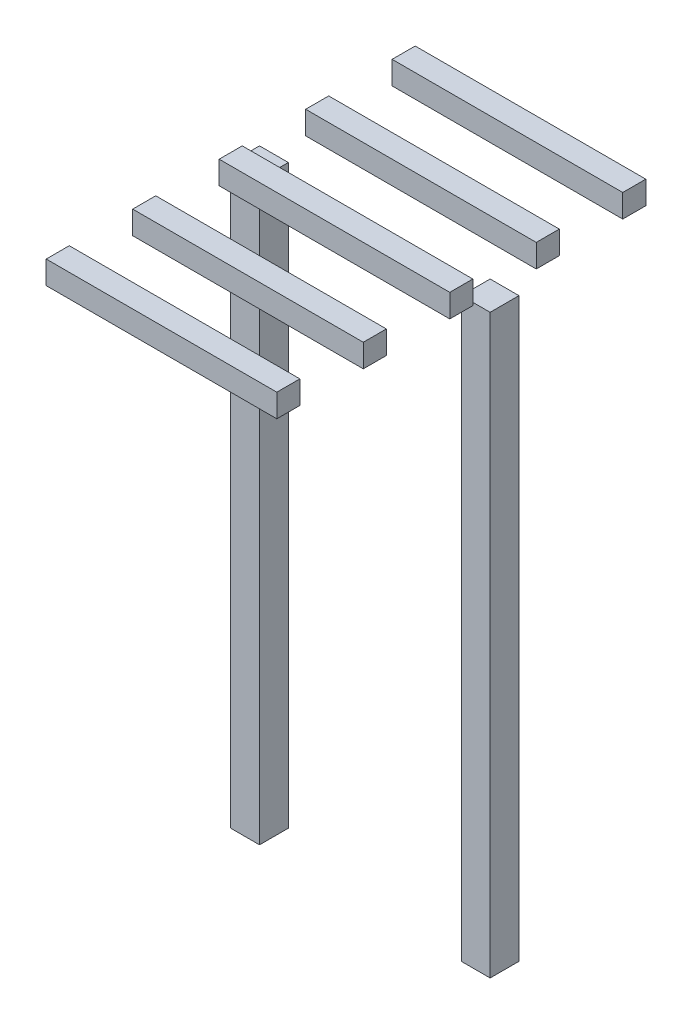
from build123d import *

# Parameters (mm, degrees)
SKETCH_1_W      = 100
SKETCH_1_H      = 100
EXTRUDE_1_DEPTH = 2000
SKETCH_2_W      = 100
SKETCH_2_H      = 100
EXTRUDE_2_DEPTH = 2000
SKETCH_3_W      = 800
SKETCH_3_H      = 80
EXTRUDE_3_DEPTH = 80
SKETCH_4_W      = 800
SKETCH_4_H      = 80
EXTRUDE_4_DEPTH = 80
SKETCH_5_W      = 800
SKETCH_5_H      = 80
EXTRUDE_5_DEPTH = 80
SKETCH_6_W      = 800
SKETCH_6_H      = 80
EXTRUDE_6_DEPTH = 80
SKETCH_7_W      = 800
SKETCH_7_H      = 80
EXTRUDE_7_DEPTH = 80


with BuildPart() as part:
    # 草图1 → 凸台-拉伸1 (new body)
    with BuildSketch(Plane(origin=(0, 0, 0), x_dir=(1, 0, 0), z_dir=(0, 1, 0))):
        with Locations((-400, 1000)):
            Rectangle(SKETCH_1_W, SKETCH_1_H)
    extrude(amount=EXTRUDE_1_DEPTH)


with BuildPart() as body_2:
    # 草图2 → 凸台-拉伸2 (new body)
    with BuildSketch(Plane(origin=(0, 0, 0), x_dir=(1, 0, 0), z_dir=(0, 1, 0))):
        with Locations((400, 1000)):
            Rectangle(SKETCH_2_W, SKETCH_2_H)
    extrude(amount=EXTRUDE_2_DEPTH)


with BuildPart() as body_3:
    # 草图3 → 凸台-拉伸3 (new body)
    with BuildSketch(Plane(origin=(0, 2000, 0), x_dir=(1, 0, 0), z_dir=(0, 1, 0))):
        with Locations((0, 300)):
            Rectangle(SKETCH_3_W, SKETCH_3_H)
    extrude(amount=EXTRUDE_3_DEPTH)


with BuildPart() as body_4:
    # 草图4 → 凸台-拉伸4 (new body)
    with BuildSketch(Plane(origin=(0, 2000, 0), x_dir=(1, 0, 0), z_dir=(0, 1, 0))):
        with Locations((0, 600)):
            Rectangle(SKETCH_4_W, SKETCH_4_H)
    extrude(amount=EXTRUDE_4_DEPTH)


with BuildPart() as body_5:
    # 草图5 → 凸台-拉伸5 (new body)
    with BuildSketch(Plane(origin=(0, 2000, 0), x_dir=(1, 0, 0), z_dir=(0, 1, 0))):
        with Locations((0, 900)):
            Rectangle(SKETCH_5_W, SKETCH_5_H)
    extrude(amount=EXTRUDE_5_DEPTH)


with BuildPart() as body_6:
    # 草图6 → 凸台-拉伸6 (new body)
    with BuildSketch(Plane(origin=(0, 2000, 0), x_dir=(1, 0, 0), z_dir=(0, 1, 0))):
        with Locations((0, 1200)):
            Rectangle(SKETCH_6_W, SKETCH_6_H)
    extrude(amount=EXTRUDE_6_DEPTH)


with BuildPart() as body_7:
    # 草图7 → 凸台-拉伸7 (new body)
    with BuildSketch(Plane(origin=(0, 2000, 0), x_dir=(1, 0, 0), z_dir=(0, 1, 0))):
        with Locations((0, 1500)):
            Rectangle(SKETCH_7_W, SKETCH_7_H)
    extrude(amount=EXTRUDE_7_DEPTH)


solid = Compound([part.part, body_2.part, body_3.part, body_4.part, body_5.part, body_6.part, body_7.part])
